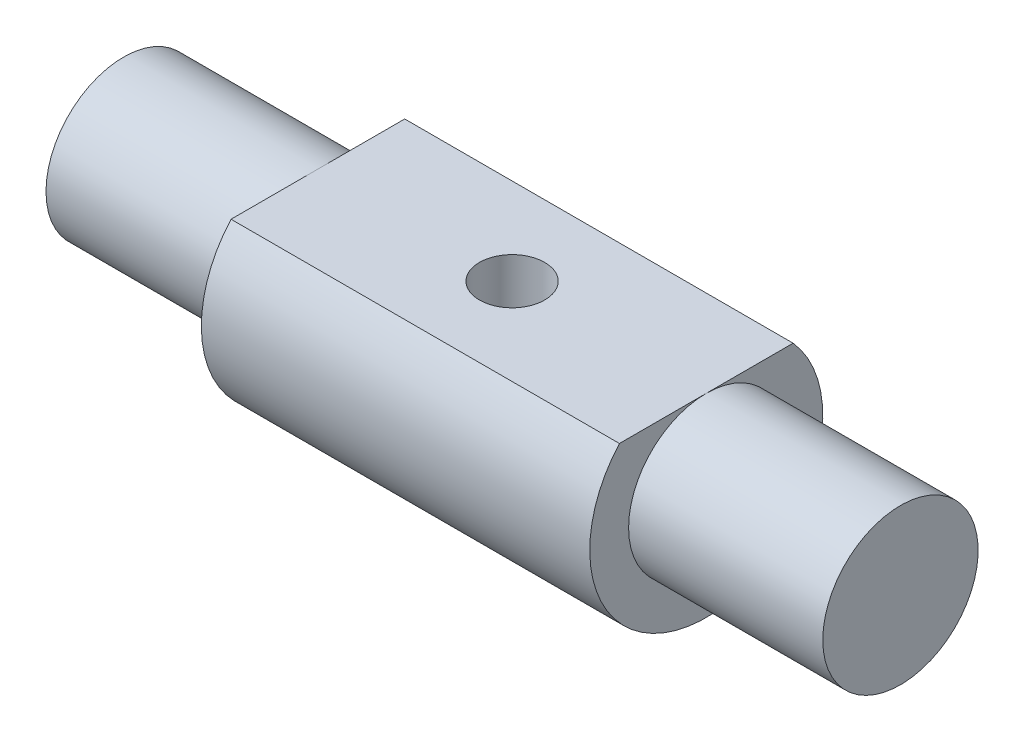
from build123d import *

# Parameters (mm, degrees)
CUT_EXTRUDE_START   = 5
SKETCH_2_W          = 25
SKETCH_2_H          = 23.22226429
CUT_EXTRUDE_1_DEPTH = 23.156951228
HOLE_WIZARD_M5_1_D  = 4.2


with BuildPart() as part:
    # 草图1 → 旋转1 (revolve)
    with BuildSketch(Plane.XY, mode=Mode.PRIVATE) as revolve_1_sk:
        Polygon((0, 7.5), (12.5, 7.5), (12.5, 5), (25, 5), (25, 0), (0, 0), align=None)
    revolve_1 = revolve(revolve_1_sk.sketch.rotate(Axis((0, 0, 0), (1, 0, 0)), 90), axis=Axis((0, 0, 0), (1, 0, 0)))

    # 镜向1: 旋转1 across plane
    add(revolve_1.mirror(Plane(origin=(0, 0, 0), x_dir=(0, 0, 1), z_dir=(1, 0, 0))))

    # 草图2 → 切除-拉伸1 (cut, through all)
    with BuildSketch(Plane(origin=(0, 0, 0), x_dir=(1, 0, 0), z_dir=(0, 1, 0)).offset(CUT_EXTRUDE_START)):
        Rectangle(SKETCH_2_W, SKETCH_2_H)
    extrude(amount=CUT_EXTRUDE_1_DEPTH, mode=Mode.SUBTRACT)

    # M5 螺纹孔的螺纹孔钻头1 (through all)
    with Locations(Plane(origin=(0, 5, 0), x_dir=(1, 0, 0), z_dir=(0, 1, 0))):
        with Locations((0, 0)):
            Hole(HOLE_WIZARD_M5_1_D / 2)


solid = part.part
